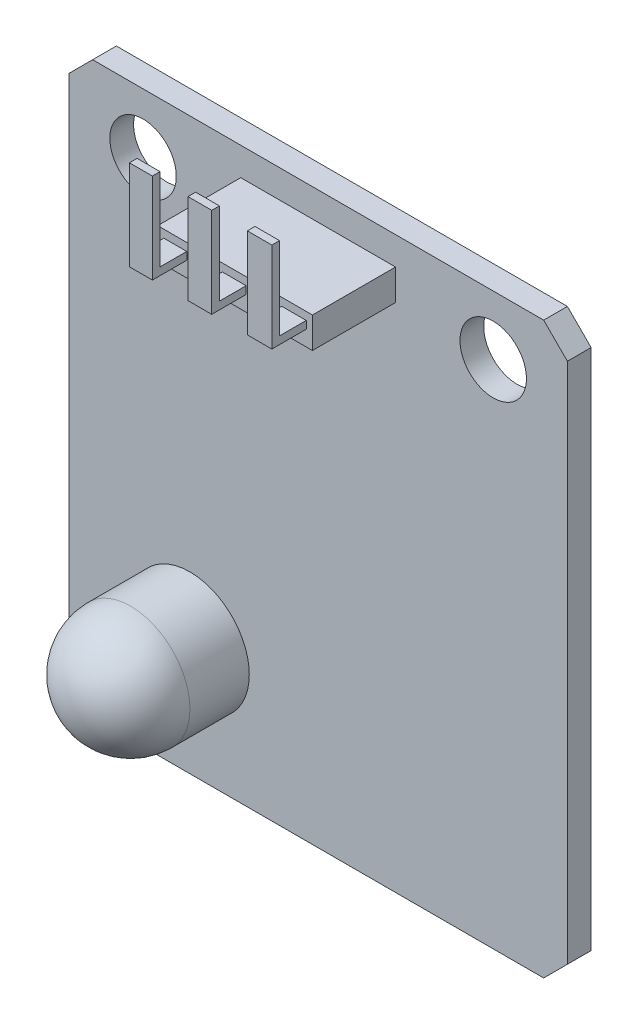
from build123d import *

# Parameters (mm, degrees)
SKETCH_2_W           = 21
SKETCH_2_H           = 24
EXTRUDE_1_DEPTH      = 1
SKETCH_3_R           = 1.4
CUT_EXTRUDE_1_DEPTH  = 16.976545309
SKETCH_4_R           = 2.5
EXTRUDE_2_DEPTH      = 5
CHAMFER_1_SIZE       = 1
FILLET_3_R           = 2.5
SKETCH_5_W           = 6.518787968
SKETCH_5_H           = 1.296166803
EXTRUDE_3_DEPTH      = 3.5
EXTRUDE_4_DEPTH      = 3
EXTRUDE_4_DEPTH_BACK = 3
SKETCH_8_W           = 1.5
SKETCH_8_H           = 1.449096172
CUT_EXTRUDE_3_DEPTH  = 19.473018506


with BuildPart() as part:
    # 草图2 → 凸台-拉伸1 (new body)
    with BuildSketch(Plane.XY):
        Rectangle(SKETCH_2_W, SKETCH_2_H)
    extrude(amount=EXTRUDE_1_DEPTH)

    # 草图3 → 切除-拉伸1 (cut, through all)
    with BuildSketch(Plane.XY.offset(1)):
        with Locations((7.375, 9.5)):
            Circle(SKETCH_3_R)
        with Locations((-7.375, 9.5)):
            Circle(SKETCH_3_R)
    extrude(amount=-CUT_EXTRUDE_1_DEPTH, mode=Mode.SUBTRACT)

    # 草图4 → 凸台-拉伸2 (add)
    with BuildSketch(Plane.XY.offset(1)):
        with Locations((-5.400830934, -7.13462041)):
            Circle(SKETCH_4_R)
    extrude(amount=EXTRUDE_2_DEPTH)

    # 倒角1
    chamfer_1_edges = [part.edges().sort_by_distance(p)[0] for p in [
        (-10.5, 12, 0.5),
        (10.5, -12, 0.5),
        (-10.5, -12, 0.5),
        (10.5, 12, 0.5),
    ]]
    chamfer(chamfer_1_edges, length=CHAMFER_1_SIZE)

    # 圆角3
    fillet_3_edges = [part.edges().sort_by_distance(p)[0] for p in [
        (-7.900830934, -7.13462041, 6),
    ]]
    fillet(fillet_3_edges, radius=FILLET_3_R)

    # 草图5 → 凸台-拉伸3 (add)
    with BuildSketch(Plane.XY.offset(1)):
        with Locations((0, 10.168737176)):
            Rectangle(SKETCH_5_W, SKETCH_5_H)
    extrude(amount=EXTRUDE_3_DEPTH)

    # 草图7 → 凸台-拉伸4 (add, two sides: drawn at the far end of the back side and taken through both)
    with BuildSketch(Plane(origin=(0, 0, 0), x_dir=(0, 0, -1), z_dir=(1, 0, 0)).offset(-EXTRUDE_4_DEPTH_BACK)):
        Polygon((-4.5, 10.48888975), (-5.626632975, 10.48888975), (-5.626632975, 13.964326433), (-5.949096172, 13.964326433), (-5.949096172, 10.168737175), (-4.5, 10.168737175), align=None)
    extrude(amount=EXTRUDE_4_DEPTH + EXTRUDE_4_DEPTH_BACK)

    # 草图8 → 切除-拉伸3 (cut, through all)
    with BuildSketch(Plane(origin=(0, 0, 0), x_dir=(1, 0, 0), z_dir=(0, 1, 0))):
        with Locations((-1.28314556, -5.224548086)):
            Rectangle(SKETCH_8_W, SKETCH_8_H)
        with Locations((1.21685444, -5.224548086)):
            Rectangle(SKETCH_8_W, SKETCH_8_H)
    extrude(amount=CUT_EXTRUDE_3_DEPTH, mode=Mode.SUBTRACT)


solid = part.part
